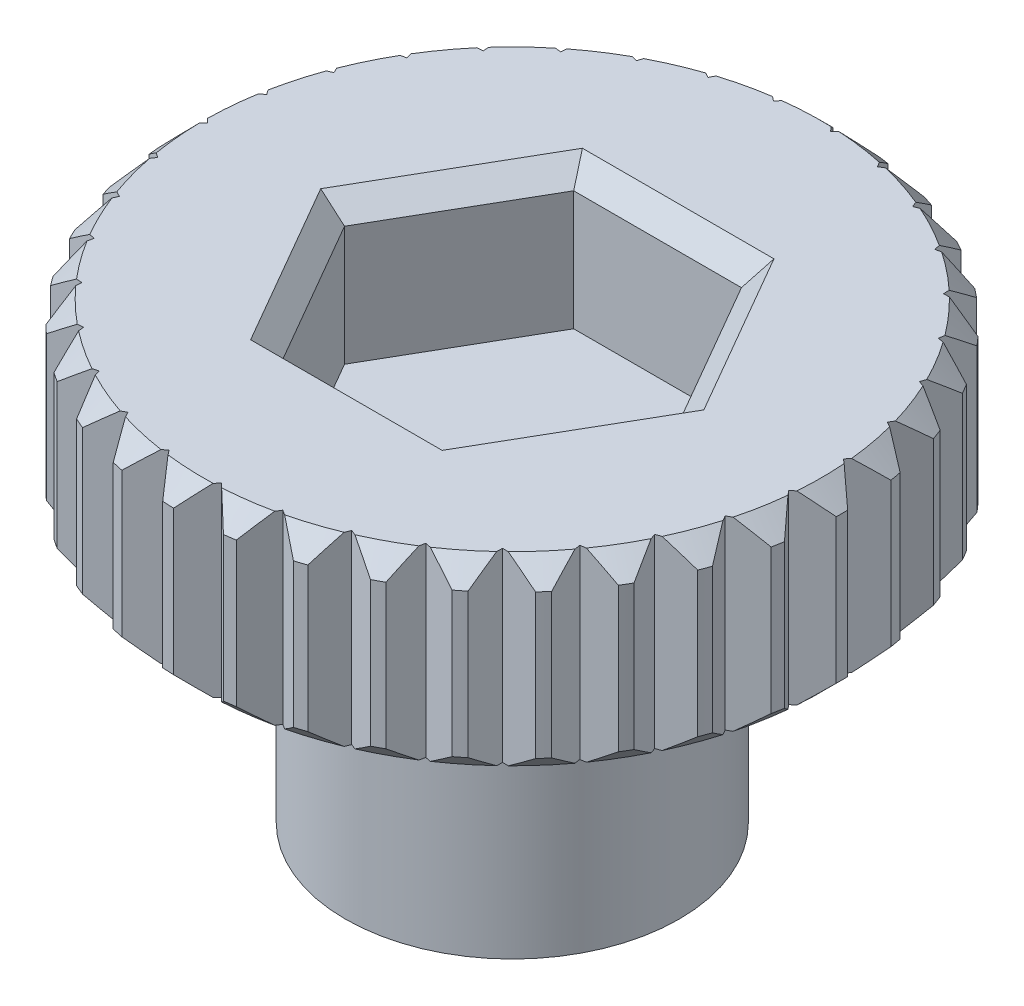
from build123d import *

# Parameters (mm, degrees)
VERTICAL_KNURL_REACH         = 17.78
VERTICAL_KNURL_PATTERN_COUNT = 35
CUT_EXTRUDE1_DEPTH           = 3.4
CHAMFER1_SIZE                = 0.5
BOSS_EXTRUDE1_START          = -0.4
SKETCH5_R                    = 2.05
BOSS_EXTRUDE1_DEPTH          = 0.4


with BuildPart() as part:
    # Layout sketch → Body (revolve)
    with BuildSketch(Plane.XY):
        Polygon((-4.05, 0), (-4.05, 6.5), (-7.5, 6.5), (-8, 7), (-8, 10.5), (-7.5, 11), (-2.55, 11), (-2.05, 10.5), (-2.05, 0.5), (-2.55, 0), align=None)
    revolve(axis=Axis((0, 0, 0), (0, 1, 0)))

    # Sketch3 → Vertical knurl (cut, up to next)
    with BuildSketch(Plane(origin=(0, 11, 0), x_dir=(1, 0, 0), z_dir=(0, 1, 0)), mode=Mode.PRIVATE) as vertical_knurl_sk1:
        Polygon((-8.4, -1), (-8.4, 1), (-7.4, 0), align=None)
    vertical_knurl_tool1 = extrude(vertical_knurl_sk1.sketch, amount=-VERTICAL_KNURL_REACH, mode=Mode.PRIVATE) & part.part
    vertical_knurl = vertical_knurl_tool1.solids().sort_by_distance((-8.066667, 11, 0))[0]
    add(vertical_knurl, mode=Mode.SUBTRACT)

    # Vertical knurl pattern: Vertical knurl ×35 about axis
    vertical_knurl_pattern_axis = Axis((0, 9.975, 0), (0, -1, 0))
    for i in range(1, VERTICAL_KNURL_PATTERN_COUNT):
        add(vertical_knurl.rotate(vertical_knurl_pattern_axis, i * 360 / VERTICAL_KNURL_PATTERN_COUNT), mode=Mode.SUBTRACT)

    # Sketch4 → Cut-Extrude1 (cut)
    with BuildSketch(Plane(origin=(0, 11, 0), x_dir=(1, 0, 0), z_dir=(0, 1, 0))):
        Polygon((4.070319398, 0), (2.035159699, 3.525), (-2.035159699, 3.525), (-4.070319398, 0), (-2.035159699, -3.525), (2.035159699, -3.525), align=None)
    extrude(amount=-CUT_EXTRUDE1_DEPTH, mode=Mode.SUBTRACT)

    # Chamfer1
    chamfer1_edges = [part.edges().sort_by_distance(p)[0] for p in [
        (-3.052739548, 11, 1.7625),
        (0, 11, 3.525),
        (3.052739548, 11, 1.7625),
        (3.052739548, 11, -1.7625),
        (0, 11, -3.525),
        (-3.052739548, 11, -1.7625),
    ]]
    chamfer(chamfer1_edges, length=CHAMFER1_SIZE)

    # Sketch5 → Boss-Extrude1 (add)
    with BuildSketch(Plane(origin=(0, 7.6, 0), x_dir=(1, 0, 0), z_dir=(0, 1, 0)).offset(BOSS_EXTRUDE1_START)):
        Circle(SKETCH5_R)
    extrude(amount=BOSS_EXTRUDE1_DEPTH)


solid = part.part
